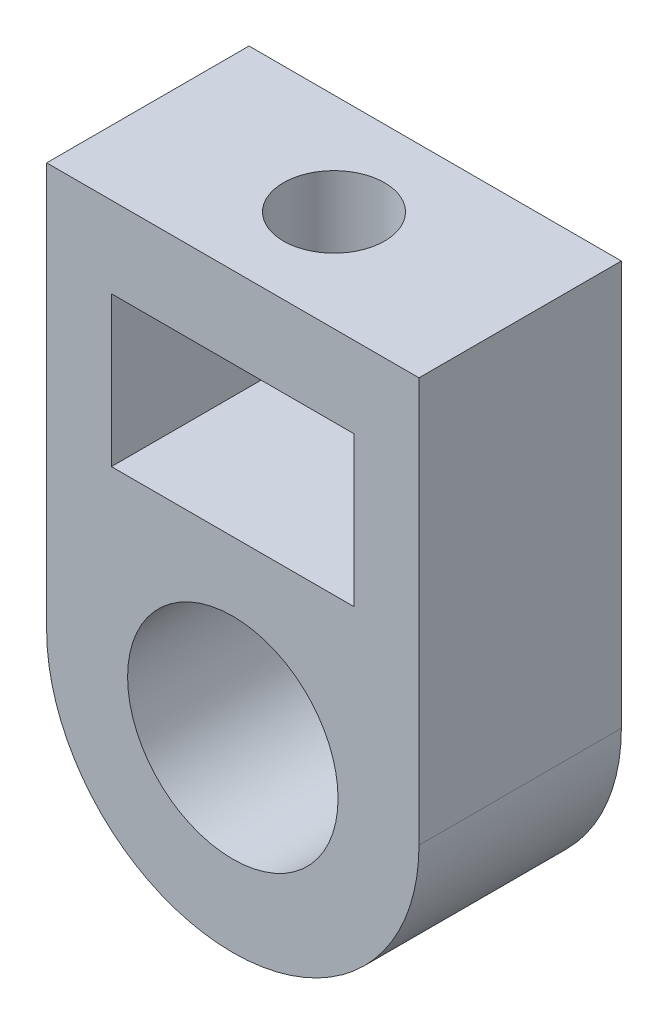
from build123d import *

# Parameters (mm, degrees)
SKETCH1_R           = 2.6
BOSS_EXTRUDE1_DEPTH = 5
SKETCH2_R           = 1.25
CUT_EXTRUDE1_DEPTH  = 2
SKETCH3_W           = 6
SKETCH3_H           = 3.7
CUT_EXTRUDE2_DEPTH  = 5


with BuildPart() as part:
    # Sketch1 → Boss-Extrude1 (new body)
    with BuildSketch(Plane.XY):
        with BuildLine():
            Line((-4.6, 0), (-4.6, 10))
            Line((-4.6, 10), (4.6, 10))
            Line((4.6, 10), (4.6, 0))
            ThreePointArc((4.6, 0), (0, -4.6), (-4.6, 0))
        make_face()
        Circle(SKETCH1_R, mode=Mode.SUBTRACT)
    extrude(amount=BOSS_EXTRUDE1_DEPTH)

    # Sketch2 → Cut-Extrude1 (cut)
    with BuildSketch(Plane(origin=(0, 10, 0), x_dir=(1, 0, 0), z_dir=(0, 1, 0))):
        with Locations(Location((0, -2.5, 0), (0, 0, 270))):
            Circle(SKETCH2_R)
    extrude(amount=-CUT_EXTRUDE1_DEPTH, mode=Mode.SUBTRACT)

    # Sketch3 → Cut-Extrude2 (cut)
    with BuildSketch(Plane.XY.offset(5)):
        with Locations((0, 6.15)):
            Rectangle(SKETCH3_W, SKETCH3_H)
    extrude(amount=-CUT_EXTRUDE2_DEPTH, mode=Mode.SUBTRACT)


solid = part.part
